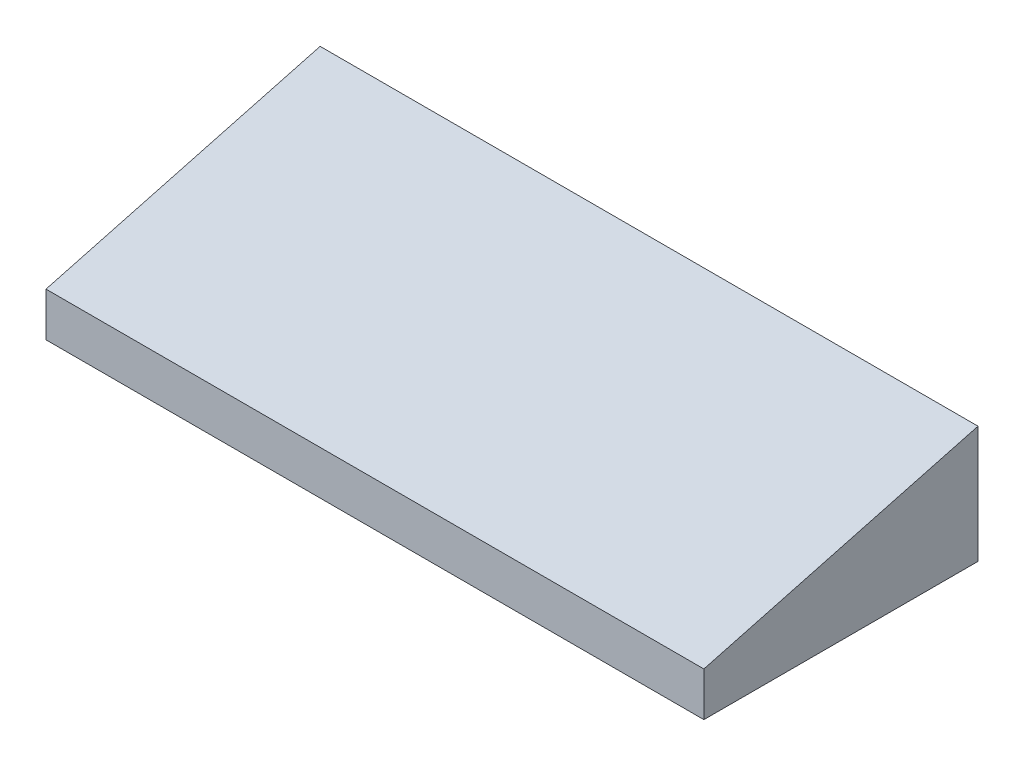
from build123d import *

# Parameters (mm, degrees)
BOSS_EXTRUDE1_DEPTH      = 60
BOSS_EXTRUDE1_DEPTH_BACK = 60


with BuildPart() as part:
    # Sketch1 → Boss-Extrude1 (new, two sides: drawn at the far end of the back side and taken through both)
    with BuildSketch(Plane(origin=(0, 0, 0), x_dir=(0, 0, -1), z_dir=(1, 0, 0)).offset(-BOSS_EXTRUDE1_DEPTH_BACK)):
        Polygon((-10, 8.010422752), (-10, 0), (40, 0), (40, 21.361127338), align=None)
    extrude(amount=BOSS_EXTRUDE1_DEPTH + BOSS_EXTRUDE1_DEPTH_BACK)


solid = part.part
